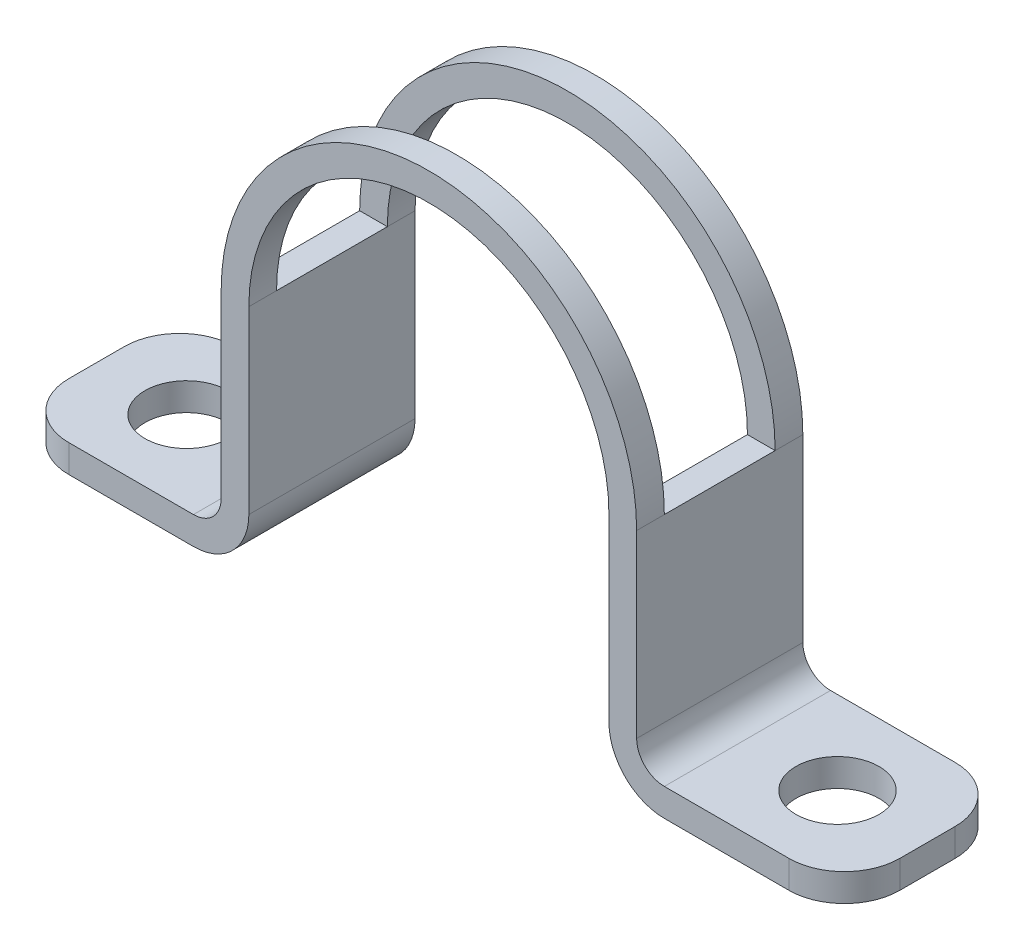
from build123d import *

# Parameters (mm, degrees)
BOSS_EXTRUDE2_DEPTH = 1
BOSS_EXTRUDE3_DEPTH = 6
SKETCH3_R           = 1.5
CUT_EXTRUDE1_DEPTH  = 6
FILLET1_R           = 2
SKETCH4_W           = 1
SKETCH4_H           = 4
BOSS_EXTRUDE4_DEPTH = 6.5


with BuildPart() as part:
    # Sketch1 → Boss-Extrude2 (new body)
    with BuildSketch(Plane.XY):
        with BuildLine():
            Line((7.5, 0), (7.5, -6.5))
            Line((7.5, -6.5), (6.5, -6.5))
            Line((6.5, -6.5), (6.5, 0))
            ThreePointArc((6.5, 0), (0, 6.5), (-6.5, 0))
            Line((-6.5, 0), (-6.5, -6.5))
            Line((-6.5, -6.5), (-7.5, -6.5))
            Line((-7.5, -6.5), (-7.5, 0))
            ThreePointArc((-7.5, 0), (0, 7.5), (7.5, 0))
        make_face()
    boss_extrude2 = extrude(amount=BOSS_EXTRUDE2_DEPTH)

    # Sketch1<4> → Boss-Extrude3 (add)
    with BuildSketch(Plane.XY):
        with BuildLine():
            Line((-7.5, -6.5), (-6.5, -6.5))
            ThreePointArc((-6.5, -6.5), (-7.085786438, -7.914213562), (-8.5, -8.5))
            Line((-8.5, -8.5), (-15, -8.5))
            Line((-15, -8.5), (-15, -7.5))
            Line((-15, -7.5), (-8.5, -7.5))
            ThreePointArc((-8.5, -7.5), (-7.792893219, -7.207106781), (-7.5, -6.5))
        make_face()
        with BuildLine():
            Line((6.5, -6.5), (7.5, -6.5))
            ThreePointArc((7.5, -6.5), (7.792893219, -7.207106781), (8.5, -7.5))
            Line((8.5, -7.5), (15, -7.5))
            Line((15, -7.5), (15, -8.5))
            Line((15, -8.5), (8.5, -8.5))
            ThreePointArc((8.5, -8.5), (7.085786438, -7.914213562), (6.5, -6.5))
        make_face()
    extrude(amount=BOSS_EXTRUDE3_DEPTH)

    # Mirror1: Boss-Extrude2 across plane
    add(boss_extrude2.mirror(Plane.XY.offset(3)))

    # Sketch3 → Cut-Extrude1 (cut)
    with BuildSketch(Plane(origin=(0, -7.5, 0), x_dir=(1, 0, 0), z_dir=(0, 1, 0))):
        with Locations(Location((-11.75, -3, 0), (0, 0, 180))):
            Circle(SKETCH3_R)
    cut_extrude1 = extrude(amount=-CUT_EXTRUDE1_DEPTH, mode=Mode.SUBTRACT)

    # Mirror2: Cut-Extrude1 across plane
    add(cut_extrude1.mirror(Plane.ZY), mode=Mode.SUBTRACT)

    # Fillet1
    fillet1_edges = [part.edges().sort_by_distance(p)[0] for p in [
        (-15, -8, 0),
        (-15, -8, 6),
        (15, -8, 6),
        (15, -8, 0),
    ]]
    fillet(fillet1_edges, radius=FILLET1_R)

    # Sketch4 → Boss-Extrude4 (add)
    with BuildSketch(Plane(origin=(0, -6.5, 0), x_dir=(1, 0, 0), z_dir=(0, 1, 0))):
        with Locations((7, -3)):
            Rectangle(SKETCH4_W, SKETCH4_H)
        with Locations((-7, -3)):
            Rectangle(SKETCH4_W, SKETCH4_H)
    extrude(amount=BOSS_EXTRUDE4_DEPTH)


solid = part.part
